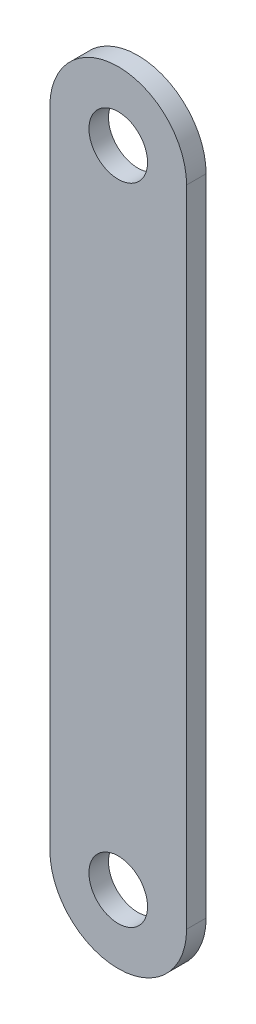
from build123d import *

# Parameters (mm, degrees)
SKETCH2_R           = 1.5
BOSS_EXTRUDE1_DEPTH = 1


with BuildPart() as part:
    # Sketch2 → Boss-Extrude1 (new body)
    with BuildSketch(Plane.XY):
        with BuildLine():
            Line((-3.5, 0), (-3.5, 33))
            ThreePointArc((-3.5, 33), (0, 36.5), (3.5, 33))
            Line((3.5, 33), (3.5, 0))
            ThreePointArc((3.5, 0), (0, -3.5), (-3.5, 0))
        make_face()
        with Locations((0, 33)):
            Circle(SKETCH2_R, mode=Mode.SUBTRACT)
        Circle(SKETCH2_R, mode=Mode.SUBTRACT)
    extrude(amount=BOSS_EXTRUDE1_DEPTH)


solid = part.part
